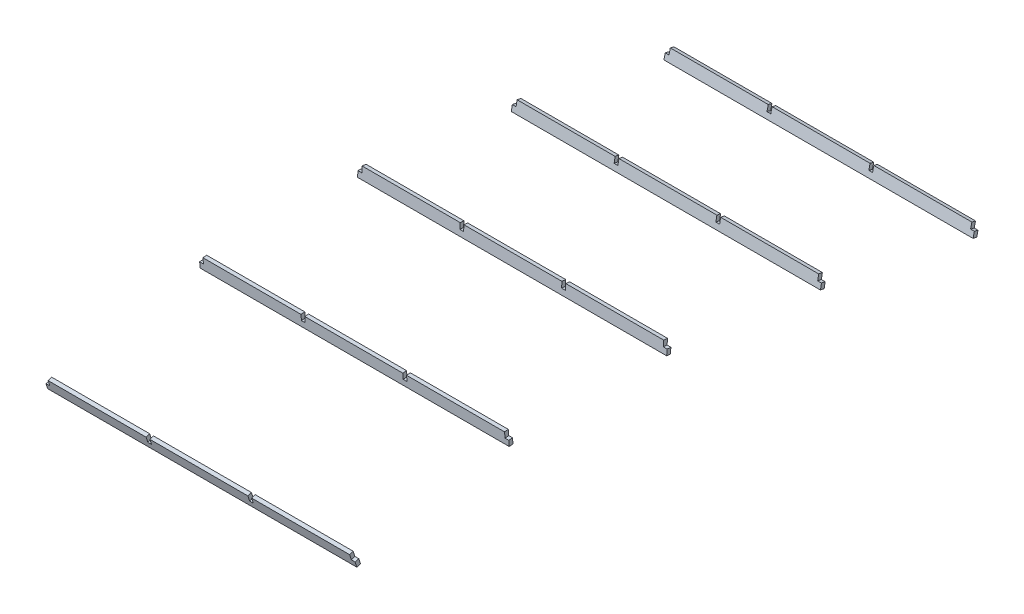
from build123d import *

# Parameters (mm, degrees)
BOSS_EXTRUDE1_START   = 1.5875
BOSS_EXTRUDE1_DEPTH   = 260.451759289
BOSS_EXTRUDE1_2_DEPTH = 260.451759289
BOSS_EXTRUDE1_3_DEPTH = 260.451759289
BOSS_EXTRUDE1_4_DEPTH = 260.451759289
BOSS_EXTRUDE1_5_DEPTH = 260.451759289
SKETCH2_W             = 3.175
SKETCH2_H             = 4.7625
CUT_EXTRUDE1_DEPTH    = 3.175
SKETCH3_W             = 3.175
SKETCH3_H             = 4.7625
CUT_EXTRUDE2_DEPTH    = 3.175
SKETCH4_W             = 3.175
SKETCH4_H             = 4.7625
CUT_EXTRUDE3_DEPTH    = 3.175
SKETCH5_W             = 3.175
SKETCH5_H             = 4.7625
CUT_EXTRUDE4_DEPTH    = 3.175
SKETCH6_W             = 3.175
SKETCH6_H             = 4.7625
CUT_EXTRUDE5_DEPTH    = 3.175
LPATTERN1_COUNT       = 4
LPATTERN1_PITCH       = 85.758919763


with BuildPart() as part:
    # Sketch1 → Boss-Extrude1 (new body)
    with BuildSketch(Plane(origin=(0, 0, 0), x_dir=(0, 0, -1), z_dir=(1, 0, 0)).offset(BOSS_EXTRUDE1_START)):
        Polygon((80.821047426, 50.440654814), (83.763552453, 41.381555015), (80.74385252, 40.400720006), (77.801347493, 49.459819805), align=None)
    extrude(amount=BOSS_EXTRUDE1_DEPTH)

    # Sketch2 → Cut-Extrude1 (cut)
    with BuildSketch(Plane(origin=(0, 27.579277656, -84.908411847), x_dir=(1, 0, 0), z_dir=(0, -0.30892441225152295, 0.9510865930687128))):
        with Locations((3.175, 20.624585966)):
            Rectangle(SKETCH2_W, SKETCH2_H)
    cut_extrude1 = extrude(amount=-CUT_EXTRUDE1_DEPTH, mode=Mode.SUBTRACT)


with BuildPart() as body_2:
    # Sketch1 → Boss-Extrude1 2 (new body)
    with BuildSketch(Plane(origin=(0, 0, 0), x_dir=(0, 0, -1), z_dir=(1, 0, 0)).offset(BOSS_EXTRUDE1_START)):
        Polygon((345.675077754, 73.375912373), (344.930911169, 63.880026891), (341.765616008, 64.128082419), (342.509782594, 73.623967902), align=None)
    extrude(amount=BOSS_EXTRUDE1_2_DEPTH)

    # Sketch4 → Cut-Extrude3 (cut)
    with BuildSketch(Plane(origin=(0, -26.228319642, -334.684631792), x_dir=(1, 0, 0), z_dir=(0, 0.078127725529898, 0.9969433577207508))):
        with Locations((3.175, 97.777186054)):
            Rectangle(SKETCH4_W, SKETCH4_H)
    cut_extrude3 = extrude(amount=-CUT_EXTRUDE3_DEPTH, mode=Mode.SUBTRACT)


with BuildPart() as body_3:
    # Sketch1 → Boss-Extrude1 3 (new body)
    with BuildSketch(Plane(origin=(0, 0, 0), x_dir=(0, 0, -1), z_dir=(1, 0, 0)).offset(BOSS_EXTRUDE1_START)):
        Polygon((476.132855024, 56.166956358), (474.485725341, 46.785453877), (471.358557847, 47.334497105), (473.005687531, 56.715999586), align=None)
    extrude(amount=BOSS_EXTRUDE1_3_DEPTH)

    # Sketch5 → Cut-Extrude4 (cut)
    with BuildSketch(Plane(origin=(0, -78.867156319, -449.201074031), x_dir=(1, 0, 0), z_dir=(0, 0.17292700084736787, 0.984934643708878))):
        with Locations((3.175, 135.275757773)):
            Rectangle(SKETCH5_W, SKETCH5_H)
    cut_extrude4 = extrude(amount=-CUT_EXTRUDE4_DEPTH, mode=Mode.SUBTRACT)


with BuildPart() as body_4:
    # Sketch1 → Boss-Extrude1 4 (new body)
    with BuildSketch(Plane(origin=(0, 0, 0), x_dir=(0, 0, -1), z_dir=(1, 0, 0)).offset(BOSS_EXTRUDE1_START)):
        Polygon((605.172771663, 29.278270064), (602.997896818, 20.004891801), (599.906770731, 20.729850083), (602.081645575, 30.003228346), align=None)
    extrude(amount=BOSS_EXTRUDE1_4_DEPTH)

    # Sketch6 → Cut-Extrude5 (cut)
    with BuildSketch(Plane(origin=(0, -132.27936555, -564.021693621), x_dir=(1, 0, 0), z_dir=(0, 0.22833331699694842, 0.9735830197518707))):
        with Locations((3.175, 164.304682892)):
            Rectangle(SKETCH6_W, SKETCH6_H)
    cut_extrude5 = extrude(amount=-CUT_EXTRUDE5_DEPTH, mode=Mode.SUBTRACT)


with BuildPart() as body_5:
    # Sketch1 → Boss-Extrude1 5 (new body)
    with BuildSketch(Plane(origin=(0, 0, 0), x_dir=(0, 0, -1), z_dir=(1, 0, 0)).offset(BOSS_EXTRUDE1_START)):
        Polygon((208.355240654, 73.763743723), (211.520313463, 74.014620422), (212.27294356, 64.519401997), (209.107870751, 64.268525298), align=None)
    extrude(amount=BOSS_EXTRUDE1_5_DEPTH)

    # Sketch3 → Cut-Extrude2 (cut)
    with BuildSketch(Plane(origin=(0, 16.872530141, -212.864672421), x_dir=(1, 0, 0), z_dir=(0, -0.07901628315628466, 0.996873325451216))):
        with Locations((3.175, 54.68840181)):
            Rectangle(SKETCH3_W, SKETCH3_H)
    cut_extrude2 = extrude(amount=-CUT_EXTRUDE2_DEPTH, mode=Mode.SUBTRACT)


with BuildPart() as lpattern1_tool:
    # LPattern1: Cut-Extrude1, Cut-Extrude2, Cut-Extrude3, Cut-Extrude4, Cut-Extrude5 ×4
    with Locations(*[(i * LPATTERN1_PITCH, 0, 0) for i in range(1, LPATTERN1_COUNT)]):
        add(cut_extrude1)
        add(cut_extrude2)
        add(cut_extrude3)
        add(cut_extrude4)
        add(cut_extrude5)


with BuildPart() as part_1:
    add(part.part)

    # LPattern1: cut by lpattern1_tool
    add(lpattern1_tool.part, mode=Mode.SUBTRACT)


with BuildPart() as body_2_1:
    add(body_2.part)

    # LPattern1: cut by lpattern1_tool
    add(lpattern1_tool.part, mode=Mode.SUBTRACT)


with BuildPart() as body_3_1:
    add(body_3.part)

    # LPattern1: cut by lpattern1_tool
    add(lpattern1_tool.part, mode=Mode.SUBTRACT)


with BuildPart() as body_4_1:
    add(body_4.part)

    # LPattern1: cut by lpattern1_tool
    add(lpattern1_tool.part, mode=Mode.SUBTRACT)


with BuildPart() as body_5_1:
    add(body_5.part)

    # LPattern1: cut by lpattern1_tool
    add(lpattern1_tool.part, mode=Mode.SUBTRACT)


solid = Compound([part_1.part, body_2_1.part, body_3_1.part, body_4_1.part, body_5_1.part])
